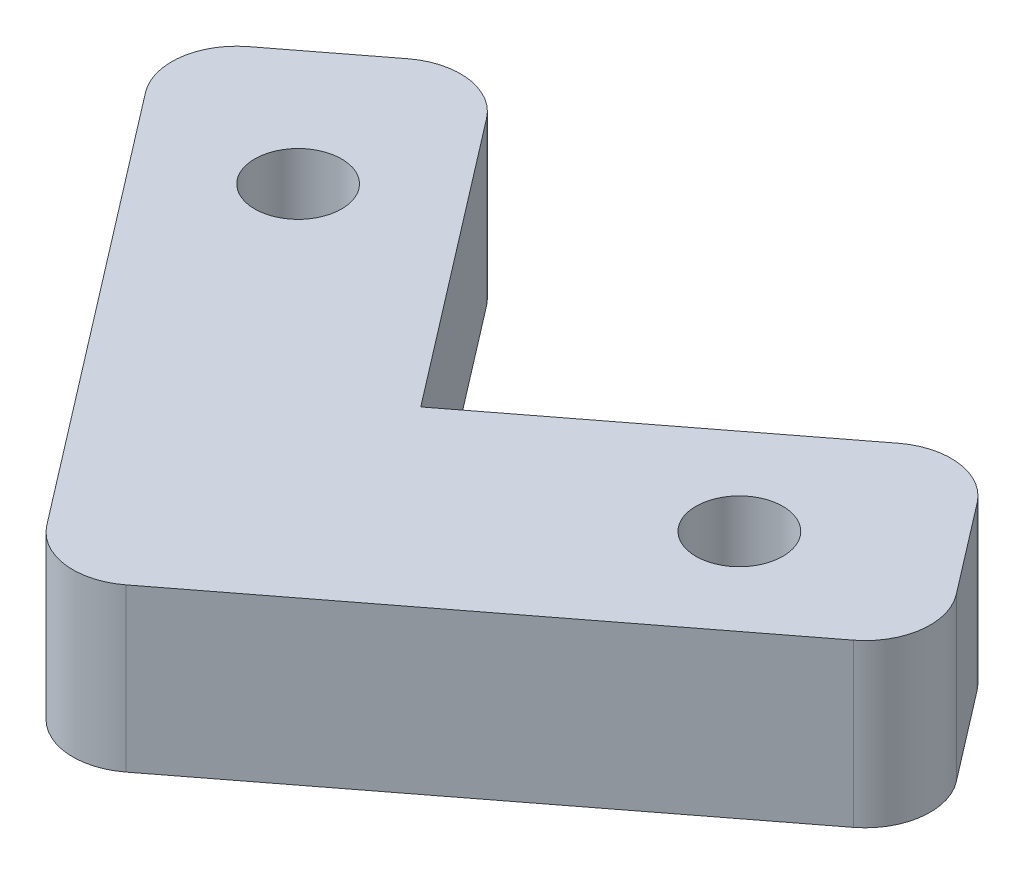
from build123d import *

# Parameters (mm, degrees)
SKETCH1_R           = 1.70053
BOSS_EXTRUDE1_DEPTH = 6.35
FILLET1_R           = 2.54


with BuildPart() as part:
    # Sketch1 → Boss-Extrude1 (new body)
    with BuildSketch(Plane(origin=(0, 0, 0), x_dir=(1, 0, 0), z_dir=(0, 1, 0))):
        Polygon((125.453583476, -114.442232973), (145.604758319, -98.979692676), (139.806305708, -91.42300211), (127.211821431, -101.087089795), (117.161170238, -87.988826147), (109.604479672, -93.787278758), align=None)
        with Locations(Location((117.248460029, -95.925846163, 0), (0, 0, 270))):
            Circle(SKETCH1_R, mode=Mode.SUBTRACT)
        with Locations(Location((137.667738303, -99.066982467, 0), (0, 0, 270))):
            Circle(SKETCH1_R, mode=Mode.SUBTRACT)
    extrude(amount=BOSS_EXTRUDE1_DEPTH)

    # Fillet1
    fillet1_edges = [part.edges().sort_by_distance(p)[0] for p in [
        (139.806305708, 3.175, 91.42300211),
        (145.604758319, 3.175, 98.979692676),
        (125.453583476, 3.175, 114.442232973),
        (109.604479672, 3.175, 93.787278758),
        (117.161170238, 3.175, 87.988826147),
    ]]
    fillet(fillet1_edges, radius=FILLET1_R)


solid = part.part
